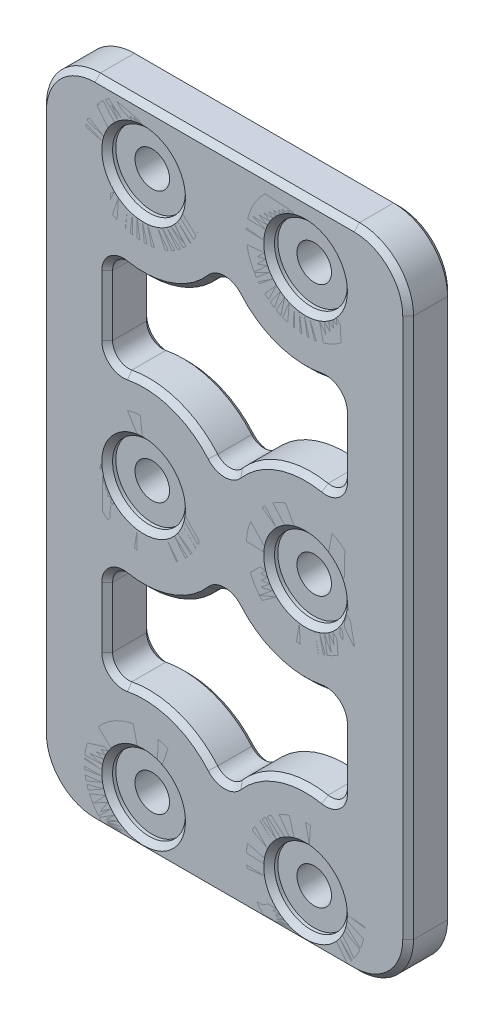
from build123d import *

# Parameters (mm, degrees)
SKETCH1_W             = 68
SKETCH1_H             = 120
SKETCH1_R             = 3.2
BOSS_EXTRUDE1_DEPTH   = 8.3
SKETCH2_R             = 6.75
CUT_EXTRUDE1_DEPTH    = 1.6
FILLET1_R             = 10
CUT_EXTRUDE3_DEPTH    = 139.177024139
FILLET2_R             = 3
CHAMFER1_SIZE         = 1
SKETCH4_R             = 7.75
BOSS_EXTRUDE2_DEPTH   = 8.3
BOSS_EXTRUDE2_2_DEPTH = 8.3
SKETCH4_R_2           = 11
BOSS_EXTRUDE2_3_DEPTH = 8.3
BOSS_EXTRUDE2_4_DEPTH = 8.3
BOSS_EXTRUDE2_5_DEPTH = 8.3
BOSS_EXTRUDE2_6_DEPTH = 8.3


with BuildPart() as part:
    # Sketch1 → Boss-Extrude1 (new body)
    with BuildSketch(Plane.XY):
        with Locations((-34, 60)):
            Rectangle(SKETCH1_W, SKETCH1_H)
        with Locations(Location((-49, 8.808290155, 0), (0, 0, 180))):
            Circle(SKETCH1_R, mode=Mode.SUBTRACT)
        with Locations(Location((-19, 8.808290155, 0), (0, 0, 180))):
            Circle(SKETCH1_R, mode=Mode.SUBTRACT)
        with Locations(Location((-19, 58.808290155, 0), (0, 0, 180))):
            Circle(SKETCH1_R, mode=Mode.SUBTRACT)
        with Locations(Location((-19, 108.808290155, 0), (0, 0, 180))):
            Circle(SKETCH1_R, mode=Mode.SUBTRACT)
        with Locations(Location((-49, 58.808290155, 0), (0, 0, 180))):
            Circle(SKETCH1_R, mode=Mode.SUBTRACT)
        with Locations(Location((-49, 108.808290155, 0), (0, 0, 180))):
            Circle(SKETCH1_R, mode=Mode.SUBTRACT)
    extrude(amount=BOSS_EXTRUDE1_DEPTH)

    # Sketch2 → Cut-Extrude1 (cut)
    with BuildSketch(Plane.XY.offset(8.3)):
        with Locations((-49, 8.808290155)):
            Circle(SKETCH2_R)
        with Locations((-19, 8.808290155)):
            Circle(SKETCH2_R)
        with Locations((-19, 58.808290155)):
            Circle(SKETCH2_R)
        with Locations((-19, 108.808290155)):
            Circle(SKETCH2_R)
        with Locations((-49, 58.808290155)):
            Circle(SKETCH2_R)
        with Locations((-49, 108.808290155)):
            Circle(SKETCH2_R)
    extrude(amount=-CUT_EXTRUDE1_DEPTH, mode=Mode.SUBTRACT)

    # Fillet1
    fillet1_edges = [part.edges().sort_by_distance(p)[0] for p in [
        (0, 0, 4.15),
        (-68, 0, 4.15),
        (-68, 120, 4.15),
        (0, 120, 4.15),
    ]]
    fillet(fillet1_edges, radius=FILLET1_R)

    # Sketch3 → Cut-Extrude3 (cut, through all)
    with BuildSketch(Plane.XY.offset(8.3)):
        with BuildLine():
            ThreePointArc((-12.25, 93.478580439), (-24.702826006, 93.058995709), (-34, 101.354264398))
            ThreePointArc((-34, 101.354264398), (-43.297173994, 93.058995709), (-55.75, 93.478580439))
            Line((-55.75, 93.478580439), (-55.75, 74.137999872))
            ThreePointArc((-55.75, 74.137999872), (-43.297173994, 74.557584601), (-34, 66.262315913))
            ThreePointArc((-34, 66.262315913), (-24.702826006, 74.557584601), (-12.25, 74.137999872))
            Line((-12.25, 74.137999872), (-12.25, 93.478580439))
        make_face()
        with BuildLine():
            Line((-12.25, 24.137999872), (-12.25, 43.478580439))
            ThreePointArc((-12.25, 43.478580439), (-24.702826006, 43.058995709), (-34, 51.354264398))
            ThreePointArc((-34, 51.354264398), (-43.297173994, 43.058995709), (-55.75, 43.478580439))
            Line((-55.75, 43.478580439), (-55.75, 24.137999872))
            ThreePointArc((-55.75, 24.137999872), (-43.297173994, 24.557584601), (-34, 16.262315913))
            ThreePointArc((-34, 16.262315913), (-24.702826006, 24.557584601), (-12.25, 24.137999872))
        make_face()
    extrude(amount=-CUT_EXTRUDE3_DEPTH, mode=Mode.SUBTRACT)

    # Fillet2
    fillet2_edges = [part.edges().sort_by_distance(p)[0] for p in [
        (-55.75, 93.478580439, 4.15),
        (-34, 101.354264398, 4.15),
        (-12.25, 93.478580439, 4.15),
        (-12.25, 74.137999872, 4.15),
        (-34, 66.262315913, 4.15),
        (-55.75, 74.137999872, 4.15),
        (-34, 51.354264398, 4.15),
        (-12.25, 43.478580439, 4.15),
        (-12.25, 24.137999872, 4.15),
        (-34, 16.262315913, 4.15),
        (-55.75, 24.137999872, 4.15),
        (-55.75, 43.478580439, 4.15),
    ]]
    fillet(fillet2_edges, radius=FILLET2_R)

    # Chamfer1
    chamfer1_edges = [part.edges().sort_by_distance(p)[0] for p in [
        (-45.8, 8.808290155, 0),
        (-43.481244373, 24.623024941, 8.3),
        (-43.481244373, 24.623024941, 0),
        (-55.75, 33.808290155, 8.3),
        (-55.75, 33.808290155, 0),
        (-43.481244373, 74.623024941, 8.3),
        (-43.481244373, 74.623024941, 0),
        (-55.75, 83.808290155, 8.3),
        (-55.75, 83.808290155, 0),
        (-12.25, 33.808290155, 8.3),
        (-12.25, 33.808290155, 0),
        (-24.518755627, 24.623024941, 8.3),
        (-24.518755627, 24.623024941, 0),
        (-15.8, 8.808290155, 0),
        (-12.25, 83.808290155, 8.3),
        (-12.25, 83.808290155, 0),
        (-24.518755627, 74.623024941, 8.3),
        (-24.518755627, 74.623024941, 0),
        (-24.518755627, 42.99355537, 8.3),
        (-24.518755627, 42.99355537, 0),
        (-24.518755627, 92.99355537, 8.3),
        (-24.518755627, 92.99355537, 0),
        (-43.481244373, 42.99355537, 8.3),
        (-43.481244373, 42.99355537, 0),
        (-43.481244373, 92.99355537, 8.3),
        (-43.481244373, 92.99355537, 0),
        (-54.659337482, 25.885045372, 8.3),
        (-54.659337482, 25.885045372, 0),
        (-54.659337482, 75.885045372, 8.3),
        (-54.659337482, 75.885045372, 0),
        (-13.340662518, 25.885045372, 8.3),
        (-13.340662518, 25.885045372, 0),
        (-13.340662518, 75.885045372, 8.3),
        (-13.340662518, 75.885045372, 0),
        (-13.340662518, 41.731534939, 8.3),
        (-13.340662518, 41.731534939, 0),
        (-13.340662518, 91.731534939, 8.3),
        (-13.340662518, 91.731534939, 0),
        (-54.659337482, 41.731534939, 8.3),
        (-54.659337482, 41.731534939, 0),
        (-54.659337482, 91.731534939, 8.3),
        (-54.659337482, 91.731534939, 0),
        (-34, 48.960624998, 8.3),
        (-34, 48.960624998, 0),
        (-34, 18.655955313, 8.3),
        (-34, 18.655955313, 0),
        (-34, 68.655955313, 8.3),
        (-34, 68.655955313, 0),
        (-34, 98.960624998, 8.3),
        (-34, 98.960624998, 0),
        (-15.8, 58.808290155, 0),
        (-15.8, 108.808290155, 0),
        (-45.8, 58.808290155, 0),
        (-45.8, 108.808290155, 0),
        (-55.75, 58.808290155, 8.3),
        (-25.75, 108.808290155, 8.3),
        (-25.75, 58.808290155, 8.3),
        (-25.75, 8.808290155, 8.3),
        (-55.75, 108.808290155, 8.3),
        (-55.75, 8.808290155, 8.3),
        (-34, 120, 0),
        (-34, 120, 8.3),
        (0, 60, 0),
        (-34, 0, 0),
        (-68, 60, 0),
        (-65.071067812, 117.071067812, 0),
        (-65.071067812, 2.928932188, 0),
        (-2.928932188, 2.928932188, 0),
        (-2.928932188, 117.071067812, 0),
        (0, 60, 8.3),
        (-68, 60, 8.3),
        (-34, 0, 8.3),
        (-65.071067812, 117.071067812, 8.3),
        (-65.071067812, 2.928932188, 8.3),
        (-2.928932188, 2.928932188, 8.3),
        (-2.928932188, 117.071067812, 8.3),
    ]]
    chamfer(chamfer1_edges, length=CHAMFER1_SIZE)


with BuildPart() as body_2:
    # Sketch4 → Boss-Extrude2 (new body)
    with BuildSketch(Plane.XY.offset(8.3)):
        with BuildLine():
            ThreePointArc((-53.138725703, 119), (-55.14304555, 99.683434465), (-38, 108.808290155))
            ThreePointArc((-38, 108.808290155), (-39.87514431, 114.951335706), (-44.861274297, 119))
            Line((-44.861274297, 119), (-53.138725703, 119))
        make_face()
        with Locations((-49, 108.808290155)):
            Circle(SKETCH4_R, mode=Mode.SUBTRACT)
    extrude(amount=-BOSS_EXTRUDE2_DEPTH)


with BuildPart() as body_3:
    # Sketch4 → Boss-Extrude2 2 (new body)
    with BuildSketch(Plane.XY.offset(8.3)):
        with BuildLine():
            Line((-14.861274297, 119), (-23.138725703, 119))
            ThreePointArc((-23.138725703, 119), (-25.14304555, 99.683434465), (-8, 108.808290155))
            ThreePointArc((-8, 108.808290155), (-9.87514431, 114.951335706), (-14.861274297, 119))
        make_face()
        with Locations((-19, 108.808290155)):
            Circle(SKETCH4_R, mode=Mode.SUBTRACT)
    extrude(amount=-BOSS_EXTRUDE2_2_DEPTH)


with BuildPart() as body_4:
    # Sketch4 → Boss-Extrude2 3 (new body)
    with BuildSketch(Plane.XY.offset(8.3)):
        with Locations((-49, 58.808290155)):
            Circle(SKETCH4_R_2)
        with Locations((-49, 58.808290155)):
            Circle(SKETCH4_R, mode=Mode.SUBTRACT)
    extrude(amount=-BOSS_EXTRUDE2_3_DEPTH)


with BuildPart() as body_5:
    # Sketch4 → Boss-Extrude2 4 (new body)
    with BuildSketch(Plane.XY.offset(8.3)):
        with Locations((-19, 58.808290155)):
            Circle(SKETCH4_R_2)
        with Locations((-19, 58.808290155)):
            Circle(SKETCH4_R, mode=Mode.SUBTRACT)
    extrude(amount=-BOSS_EXTRUDE2_4_DEPTH)


with BuildPart() as body_6:
    # Sketch4 → Boss-Extrude2 5 (new body)
    with BuildSketch(Plane.XY.offset(8.3)):
        with BuildLine():
            ThreePointArc((-11.252058025, 1), (-8.845509325, 4.579068107), (-8, 8.808290155))
            ThreePointArc((-8, 8.808290155), (-23.229222049, 18.96278083), (-26.747941975, 1))
            Line((-26.747941975, 1), (-11.252058025, 1))
        make_face()
        with Locations((-19, 8.808290155)):
            Circle(SKETCH4_R, mode=Mode.SUBTRACT)
    extrude(amount=-BOSS_EXTRUDE2_5_DEPTH)


with BuildPart() as body_7:
    # Sketch4 → Boss-Extrude2 6 (new body)
    with BuildSketch(Plane.XY.offset(8.3)):
        with BuildLine():
            Line((-56.747941975, 1), (-41.252058025, 1))
            ThreePointArc((-41.252058025, 1), (-38.845509325, 4.579068107), (-38, 8.808290155))
            ThreePointArc((-38, 8.808290155), (-53.229222049, 18.96278083), (-56.747941975, 1))
        make_face()
        with Locations((-49, 8.808290155)):
            Circle(SKETCH4_R, mode=Mode.SUBTRACT)
    extrude(amount=-BOSS_EXTRUDE2_6_DEPTH)


solid = Compound([part.part, body_2.part, body_3.part, body_4.part, body_5.part, body_6.part, body_7.part])
